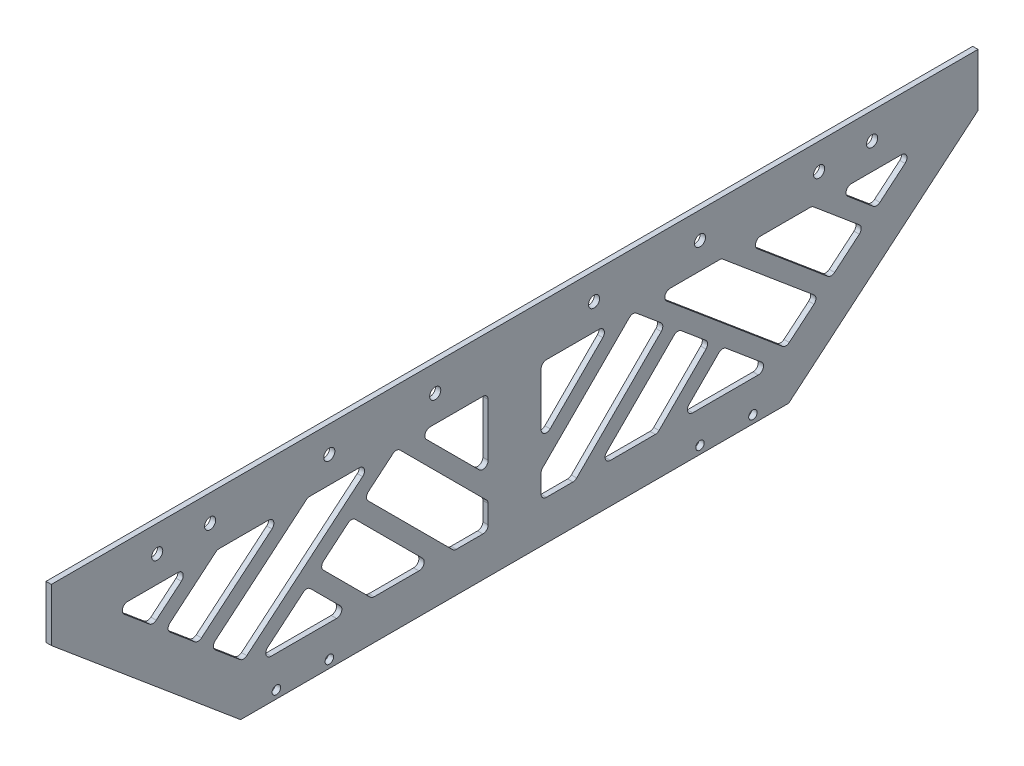
from build123d import *

# Parameters (mm, degrees)
EXTRUDE_1_DEPTH         = 2
HOLE_WIZARD_3_2_3_2_1_D = 3.2
HOLE_WIZARD_4_2_4_2_1_D = 4.2
CUT_EXTRUDE_1_DEPTH     = 193.429207762
FILLET_1_R              = 2
FILLET_1_OF_MIRROR_2_R  = 2


with BuildPart() as part:
    # 草图1 → 凸台-拉伸1 (new body)
    with BuildSketch(Plane(origin=(0, 0, 0), x_dir=(0, 0, -1), z_dir=(1, 0, 0))):
        Polygon((-103.494784444, -80), (103.494784444, -80), (175, -20), (175, 0), (-175, 0), (-175, -20), align=None)
    extrude(amount=EXTRUDE_1_DEPTH)

    # Ø3.2 (3.2) 直径孔1 (through all)
    with Locations(Plane(origin=(2, -77, 90), x_dir=(0, 0, 1), z_dir=(1, 0, 0))):
        with Locations((0, 0), (-20, 0), (-180, 0), (-160, 0)):
            Hole(HOLE_WIZARD_3_2_3_2_1_D / 2)

    # Ø4.2 (4.2) 直径孔1 (through all)
    with Locations(Plane(origin=(2, -10, 135), x_dir=(0, 0, 1), z_dir=(1, 0, 0))):
        with Locations((0, 0), (-20, 0), (-65, 0), (-105, 0)):
            hole_wizard_4_2_4_2_1 = Hole(HOLE_WIZARD_4_2_4_2_1_D / 2)

    # 镜向1: Ø4.2 (4.2) 直径孔1 across plane
    add(hole_wizard_4_2_4_2_1.mirror(Plane.XY), mode=Mode.SUBTRACT)

    # 草图6 → 切除-拉伸1 (cut, through all)
    with BuildSketch(Plane(origin=(2, 0, 0), x_dir=(0, 0, -1), z_dir=(1, 0, 0))):
        Polygon((-87.438218406, -20), (-119.551180502, -46.94597465), (-131.996971117, -36.502716336), (-112.329799636, -20), align=None)
        Polygon((-78.103875445, -20), (-114.884009021, -50.862196518), (-102.438218406, -61.305454833), (-53.212294215, -20), align=None)
        Polygon((-44.604098668, -20.609310027), (-56.907628403, -30.93319729), (-22.840825693, -65), (-10, -65), (-10, -55.213408695), align=None)
        Polygon((-151.664142597, -20), (-121.664142597, -20), (-136.664142597, -32.586494468), align=None)
        Polygon((-10, -20), (-10, -46.728127321), (-36.728127321, -20), align=None)
        Polygon((-31.326107067, -65), (-53.953524065, -65), (-73.824981789, -45.128542276), (-61.521452054, -34.804655014), align=None)
        Polygon((-78.438805439, -49), (-62.438805439, -65), (-97.506862921, -65), align=None)
    cut_extrude_1 = extrude(amount=-CUT_EXTRUDE_1_DEPTH, mode=Mode.SUBTRACT)

    # 圆角1
    fillet_1_edges = [part.edges().sort_by_distance(p)[0] for p in [
        (1, -20, 53.212294215),
        (1, -61.305454833, 102.438218406),
        (1, -50.862196518, 114.884009021),
        (1, -20, 78.103875445),
        (1, -36.502716336, 131.996971117),
        (1, -20, 112.329799636),
        (1, -20, 87.438218406),
        (1, -46.94597465, 119.551180502),
        (1, -20, 36.728127321),
        (1, -20, 10),
        (1, -46.728127321, 10),
        (1, -55.213408695, 10),
        (1, -65, 10),
        (1, -65, 22.840825693),
        (1, -30.93319729, 56.907628403),
        (1, -20.609310027, 44.604098668),
        (1, -65, 97.506862921),
        (1, -49, 78.438805439),
        (1, -65, 62.438805439),
        (1, -34.804655014, 61.521452054),
        (1, -65, 31.326107067),
        (1, -65, 53.953524065),
        (1, -45.128542276, 73.824981789),
        (1, -32.586494468, 136.664142597),
        (1, -20, 151.664142597),
        (1, -20, 121.664142597),
    ]]
    fillet(fillet_1_edges, radius=FILLET_1_R)

    # 镜向2: 切除-拉伸1 across plane
    add(cut_extrude_1.mirror(Plane.XY), mode=Mode.SUBTRACT)

    # 圆角1 of 镜向2
    fillet_1_of_mirror_2_edges = [part.edges().sort_by_distance(p)[0] for p in [
        (1, -20, -53.212294215),
        (1, -61.305454833, -102.438218406),
        (1, -50.862196518, -114.884009021),
        (1, -20, -78.103875445),
        (1, -36.502716336, -131.996971117),
        (1, -20, -112.329799636),
        (1, -20, -87.438218406),
        (1, -46.94597465, -119.551180502),
        (1, -20, -36.728127321),
        (1, -20, -10),
        (1, -46.728127321, -10),
        (1, -55.213408695, -10),
        (1, -65, -10),
        (1, -65, -22.840825693),
        (1, -30.93319729, -56.907628403),
        (1, -20.609310027, -44.604098668),
        (1, -65, -97.506862921),
        (1, -49, -78.438805439),
        (1, -65, -62.438805439),
        (1, -34.804655014, -61.521452054),
        (1, -65, -31.326107067),
        (1, -65, -53.953524065),
        (1, -45.128542276, -73.824981789),
        (1, -32.586494468, -136.664142597),
        (1, -20, -151.664142597),
        (1, -20, -121.664142597),
    ]]
    fillet(fillet_1_of_mirror_2_edges, radius=FILLET_1_OF_MIRROR_2_R)


solid = part.part
